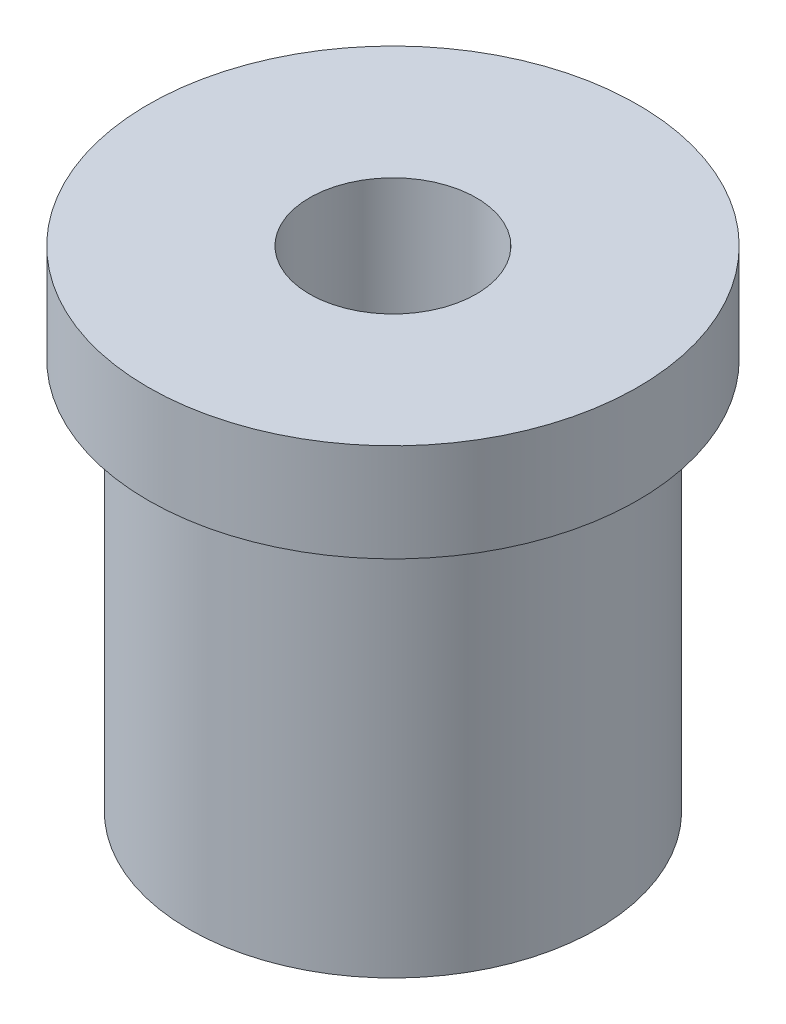
from build123d import *

# Parameters (mm, degrees)
SKETCH1_R           = 7.9375
SKETCH1_R_2         = 2.7051
BOSS_EXTRUDE1_DEPTH = 3.175
BOSS_EXTRUDE2_START = -12.7
SKETCH1_3_R         = 6.6167
SKETCH1_3_R_2       = 2.7051
BOSS_EXTRUDE2_DEPTH = 12.7


with BuildPart() as part:
    # Sketch1 → Boss-Extrude1 (new body)
    with BuildSketch(Plane(origin=(0, 0, 0), x_dir=(1, 0, 0), z_dir=(0, 1, 0))):
        Circle(SKETCH1_R)
        Circle(SKETCH1_R_2, mode=Mode.SUBTRACT)
    extrude(amount=BOSS_EXTRUDE1_DEPTH)

    # Sketch1<3> → Boss-Extrude2 (add)
    with BuildSketch(Plane(origin=(0, 0, 0), x_dir=(1, 0, 0), z_dir=(0, 1, 0)).offset(BOSS_EXTRUDE2_START)):
        Circle(SKETCH1_3_R)
        Circle(SKETCH1_3_R_2, mode=Mode.SUBTRACT)
    extrude(amount=BOSS_EXTRUDE2_DEPTH)


solid = part.part
